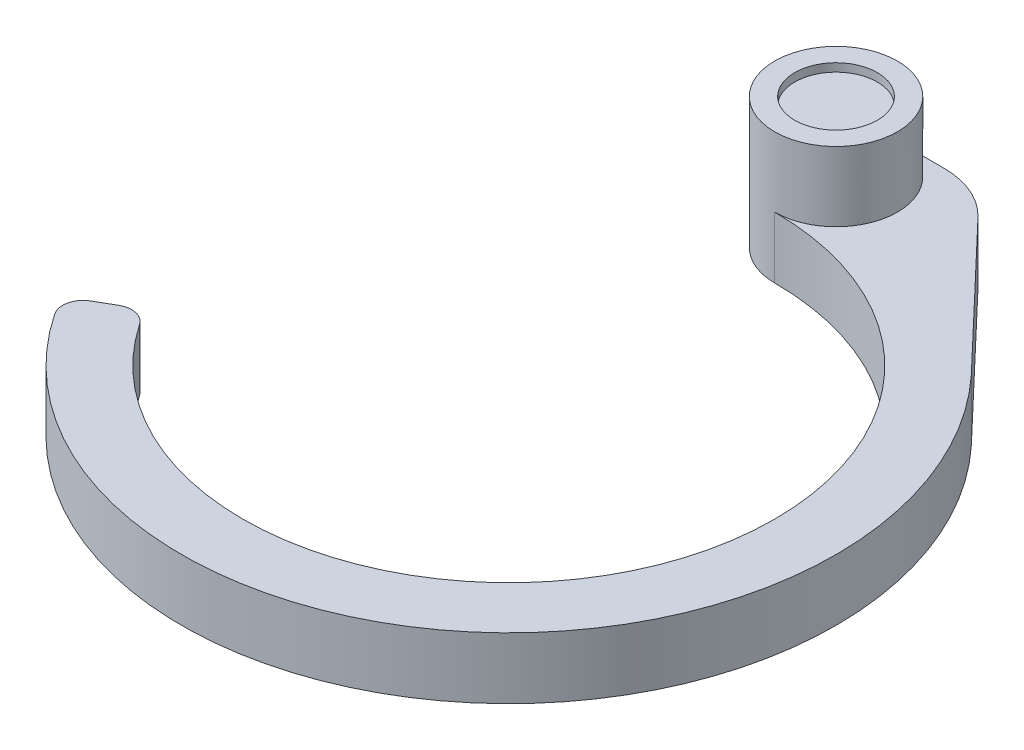
from build123d import *

# Parameters (mm, degrees)
EXTRUDE_4_DEPTH     = 15
SKETCH_4_R          = 15
EXTRUDE_5_DEPTH     = 17
SKETCH_6_R          = 10.1
CUT_EXTRUDE_1_DEPTH = 2


with BuildPart() as part:
    # ｽｹｯﾁ2 → ﾎﾞｽ - 押し出し4 (new body)
    with BuildSketch(Plane(origin=(0, 0, 0), x_dir=(1, 0, 0), z_dir=(0, 1, 0))):
        with BuildLine():
            ThreePointArc((-53.82643789, -36.437818048), (-56.846261527, -34.367935813), (-60.466933112, -34.910600109))
            Line((-60.466933112, -34.910600109), (-64.807406984, -37.416573868))
            ThreePointArc((-64.807406984, -37.416573868), (-67.177509772, -40.614402853), (-66.461234116, -44.529814279))
            ThreePointArc((-66.461234116, -44.529814279), (49.665387485, -62.716419588), (58.57572973, 54.487465409))
            Line((58.57572973, 54.487465409), (57.289371136, 55.838409315))
            Line((57.289371136, 55.838409315), (25.911523347, 88.791671712))
            ThreePointArc((25.911523347, 88.791671712), (19.306695871, 93.382511176), (11.427401304, 95))
            Line((11.427401304, 95), (0, 95))
            ThreePointArc((0, 95), (-15, 80), (0, 65))
            ThreePointArc((0, 65), (57.41714976, -30.467538684), (-53.82643789, -36.437818048))
        make_face()
    extrude(amount=EXTRUDE_4_DEPTH)

    # ｽｹｯﾁ4 → ﾎﾞｽ - 押し出し5 (add)
    with BuildSketch(Plane(origin=(0, 15, 0), x_dir=(1, 0, 0), z_dir=(0, 1, 0))):
        with Locations(Location((0, 80, 0), (0, 0, 270))):
            Circle(SKETCH_4_R)
    extrude(amount=EXTRUDE_5_DEPTH)

    # ｽｹｯﾁ6 → ｶｯﾄ - 押し出し1 (cut)
    with BuildSketch(Plane(origin=(0, 32, 0), x_dir=(1, 0, 0), z_dir=(0, 1, 0))):
        with Locations(Location((0, 80, 0), (0, 0, 270))):
            Circle(SKETCH_6_R)
    extrude(amount=-CUT_EXTRUDE_1_DEPTH, mode=Mode.SUBTRACT)


solid = part.part
